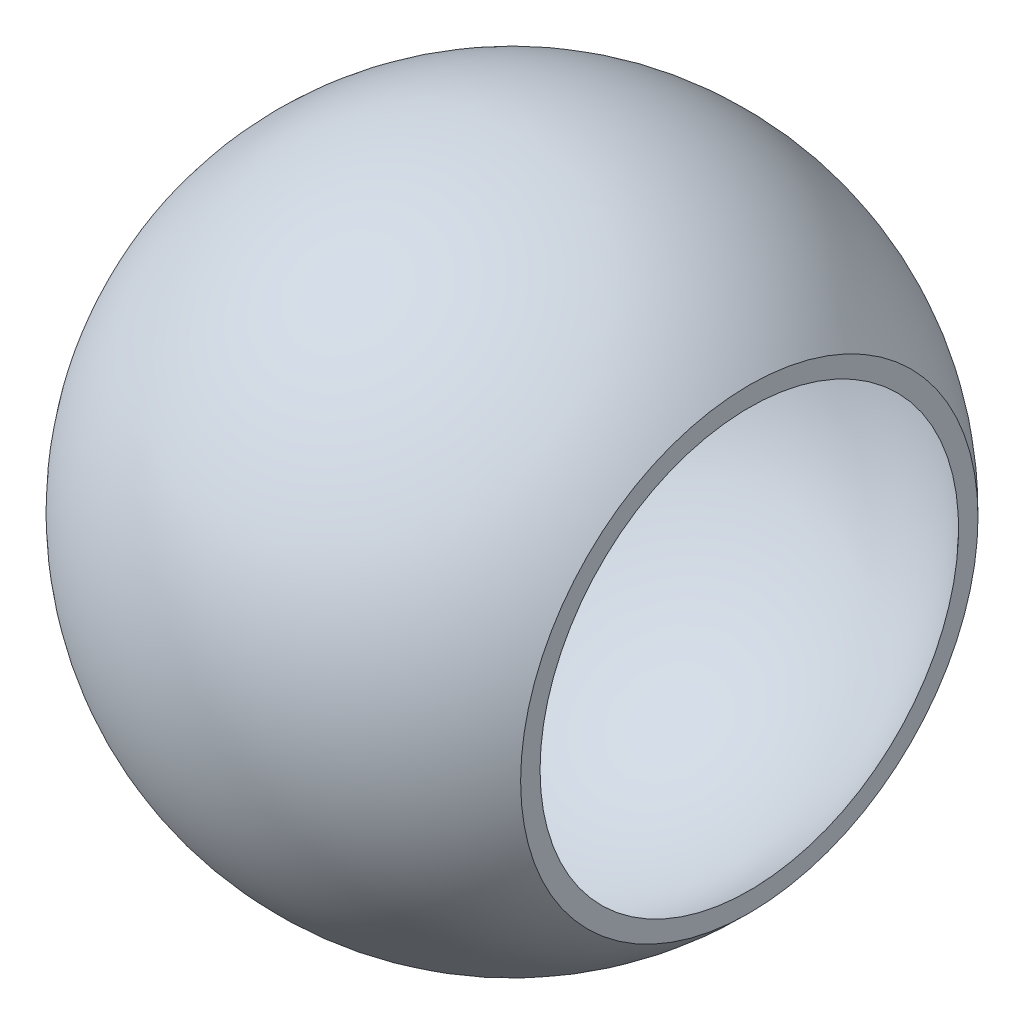
from build123d import *

# Parameters (mm, degrees)
BOSS_EXTRUDE1_REACH      = 150.085
BOSS_EXTRUDE1_END_RADIUS = 60.96
BOSS_EXTRUDE1_START      = -38.1
SKETCH2_R                = 21.59
SKETCH2_R_2              = 17.145


with BuildPart() as part:
    # Sketch1 → Revolve1 (revolve)
    with BuildSketch(Plane.XY):
        with BuildLine():
            Line((-63.5, 0), (-60.96, 0))
            ThreePointArc((-60.96, 0), (-21.552614691, 57.022858574), (45.72, 40.321249981))
            Line((45.72, 40.321249981), (45.72, 44.067352995))
            ThreePointArc((45.72, 44.067352995), (-23.759524406, 58.887477446), (-63.5, 0))
        make_face()
    revolve(axis=Axis((-63.5, 0, 0), (1, 0, 0)))

    # Boss-Extrude1: up to this sphere (the profile starts inside it)
    boss_extrude1_end = Location((0, 0, 0)) * Sphere(BOSS_EXTRUDE1_END_RADIUS, mode=Mode.PRIVATE)
    # Sketch2 → Boss-Extrude1 (add, up to the surface)
    with BuildSketch(Plane(origin=(0, 0, 0), x_dir=(0, 0, -1), z_dir=(1, 0, 0)).offset(BOSS_EXTRUDE1_START), mode=Mode.PRIVATE) as boss_extrude1_sk1:
        with Locations((0, 10.0076)):
            Circle(SKETCH2_R)
        with Locations((0, 10.0076)):
            Circle(SKETCH2_R_2, mode=Mode.SUBTRACT)
    boss_extrude1_tool1 = extrude(boss_extrude1_sk1.sketch, amount=-BOSS_EXTRUDE1_REACH, mode=Mode.PRIVATE) & boss_extrude1_end
    add(boss_extrude1_tool1.solids().sort_by_distance((-38.1, 10.0076, 20.979343))[0])


solid = part.part
